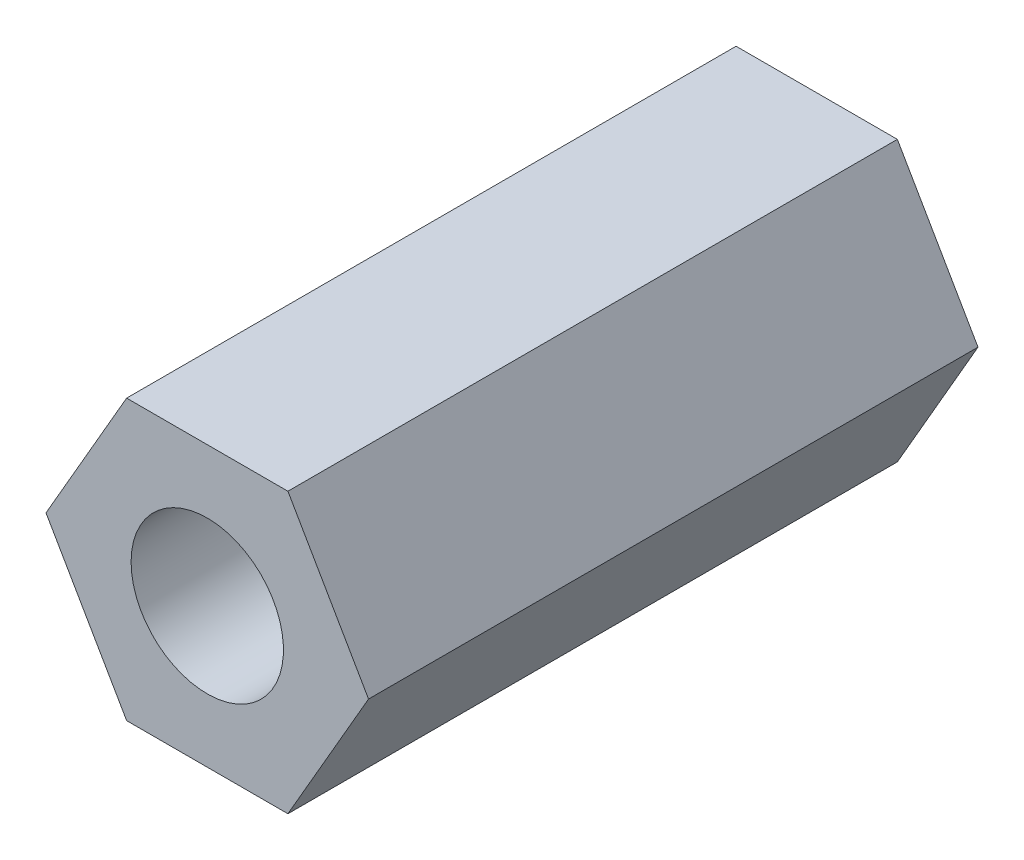
from build123d import *

# Parameters (mm, degrees)
BASE_EXTRUSION_DEPTH    = 12
ESQUISSE3_R             = 1.5
ENL_V_MAT_EXTRU_1_DEPTH = 13.714001468


with BuildPart() as part:
    # Esquisse1 → Base-Extrusion (new body)
    with BuildSketch(Plane.XY):
        Polygon((1.58771324, 2.75), (-1.58771324, 2.75), (-3.175426481, 0), (-1.58771324, -2.75), (1.58771324, -2.75), (3.175426481, 0), align=None)
    extrude(amount=BASE_EXTRUSION_DEPTH)

    # Esquisse3 → Enlèv. mat.-Extru.1 (cut, through all)
    with BuildSketch(Plane(origin=(0, 0, 0), x_dir=(-1, 0, 0), z_dir=(0, 0, -1))):
        Circle(ESQUISSE3_R)
    extrude(amount=-ENL_V_MAT_EXTRU_1_DEPTH, mode=Mode.SUBTRACT)


solid = part.part
